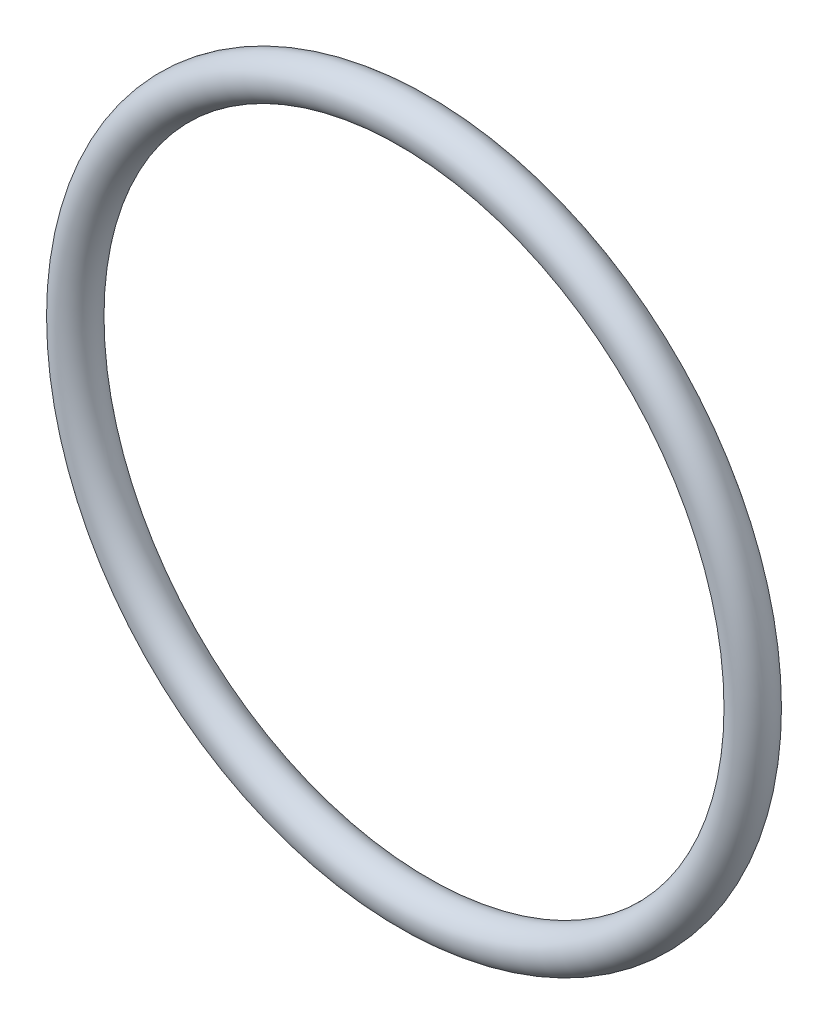
from build123d import *

# Parameters (mm, degrees)
SWEEP1_PROFILE_R = 1.524


with BuildPart() as part:
    # Sweep1: sweep along a path in Sketch1
    with BuildLine(Plane.XY) as sweep1_path:
        CenterArc((0, 0), 25.4, 0, 360)
    # Sweep1 profile (on start of the path) → Sweep1 (sweep)
    with BuildSketch(Plane(origin=(25.4, 0, 0), x_dir=(0, 0, 1), z_dir=(0, 1, 0))):
        Circle(SWEEP1_PROFILE_R)
    sweep(path=sweep1_path.line)


solid = part.part
